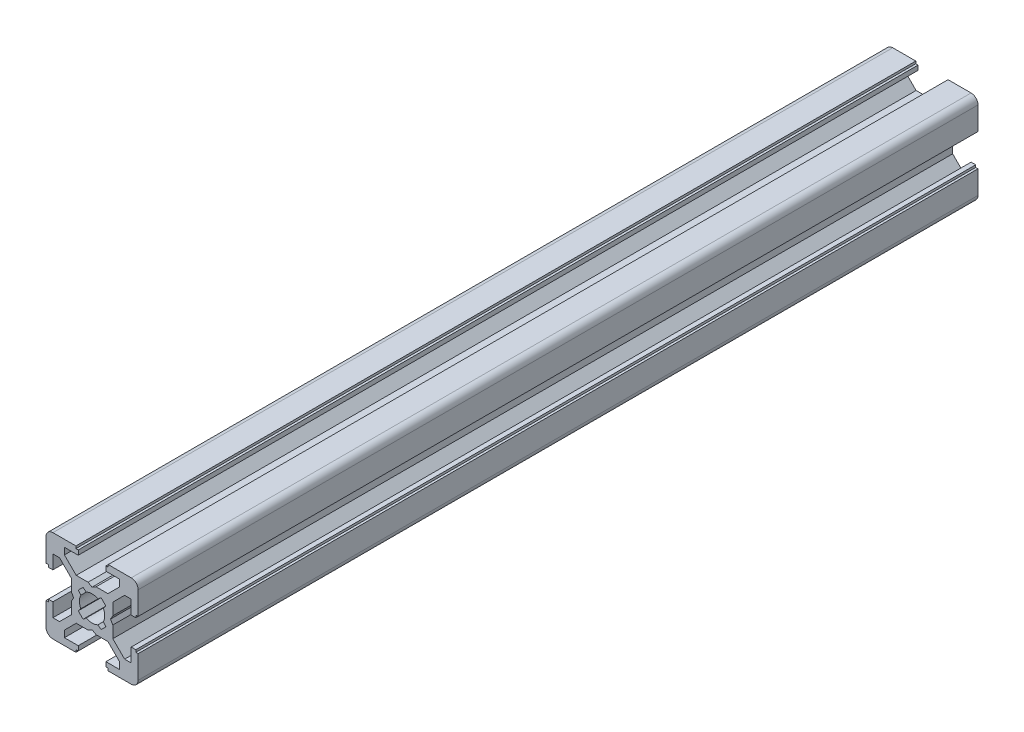
from build123d import *

# Parameters (mm, degrees)
BOSS_EXTRU_1_DEPTH      = 182.28
ENL_V_MAT_EXTRU_1_DEPTH = 183.827783447


with BuildPart() as part:
    # Esquisse1 → Boss.-Extru.1 (new body)
    with BuildSketch(Plane.XY):
        with BuildLine():
            Line((-4, 0), (-4.5, 0.866025404))
            Line((-4.5, 0.866025404), (-4.5, 3.439339828))
            Line((-4.5, 3.439339828), (-7.060660172, 6))
            Line((-7.060660172, 6), (-8.5, 6))
            Line((-8.5, 6), (-8.5, 3))
            Line((-8.5, 3), (-9.5, 3))
            Line((-9.5, 3), (-9.5, 3.5))
            Line((-9.5, 3.5), (-10, 3.5))
            Line((-10, 3.5), (-10, 8.5))
            ThreePointArc((-10, 8.5), (-9.560660172, 9.560660172), (-8.5, 10))
            Line((-8.5, 10), (-3.5, 10))
            Line((-3.5, 10), (-3.5, 9.5))
            Line((-3.5, 9.5), (-3, 9.5))
            Line((-3, 9.5), (-3, 8.5))
            Line((-3, 8.5), (-6, 8.5))
            Line((-6, 8.5), (-6, 7.060660172))
            Line((-6, 7.060660172), (-3.439339828, 4.5))
            Line((-3.439339828, 4.5), (-0.866025404, 4.5))
            Line((-0.866025404, 4.5), (0, 4))
            Line((0, 4), (0.866025404, 4.5))
            Line((0.866025404, 4.5), (3.439339828, 4.5))
            Line((3.439339828, 4.5), (6, 7.060660172))
            Line((6, 7.060660172), (6, 8.5))
            Line((6, 8.5), (3, 8.5))
            Line((3, 8.5), (3, 9.5))
            Line((3, 9.5), (3.5, 9.5))
            Line((3.5, 9.5), (3.5, 10))
            Line((3.5, 10), (8.5, 10))
            ThreePointArc((8.5, 10), (9.560660172, 9.560660172), (10, 8.5))
            Line((10, 8.5), (10, 3.5))
            Line((10, 3.5), (9.5, 3.5))
            Line((9.5, 3.5), (9.5, 3))
            Line((9.5, 3), (8.5, 3))
            Line((8.5, 3), (8.5, 6))
            Line((8.5, 6), (7.060660172, 6))
            Line((7.060660172, 6), (4.5, 3.439339828))
            Line((4.5, 3.439339828), (4.5, 0.866025404))
            Line((4.5, 0.866025404), (4, 0))
            Line((4, 0), (4.5, -0.866025404))
            Line((4.5, -0.866025404), (4.5, -3.439339828))
            Line((4.5, -3.439339828), (7.060660172, -6))
            Line((7.060660172, -6), (8.5, -6))
            Line((8.5, -6), (8.5, -3))
            Line((8.5, -3), (9.5, -3))
            Line((9.5, -3), (9.5, -3.5))
            Line((9.5, -3.5), (10, -3.5))
            Line((10, -3.5), (10, -8.5))
            ThreePointArc((10, -8.5), (9.560660172, -9.560660172), (8.5, -10))
            Line((8.5, -10), (3.5, -10))
            Line((3.5, -10), (3.5, -9.5))
            Line((3.5, -9.5), (3, -9.5))
            Line((3, -9.5), (3, -8.5))
            Line((3, -8.5), (6, -8.5))
            Line((6, -8.5), (6, -7.060660172))
            Line((6, -7.060660172), (3.439339828, -4.5))
            Line((3.439339828, -4.5), (0.866025404, -4.5))
            Line((0.866025404, -4.5), (0, -4))
            Line((0, -4), (-0.866025404, -4.5))
            Line((-0.866025404, -4.5), (-3.439339828, -4.5))
            Line((-3.439339828, -4.5), (-6, -7.060660172))
            Line((-6, -7.060660172), (-6, -8.5))
            Line((-6, -8.5), (-3, -8.5))
            Line((-3, -8.5), (-3, -9.5))
            Line((-3, -9.5), (-3.5, -9.5))
            Line((-3.5, -9.5), (-3.5, -10))
            Line((-3.5, -10), (-8.5, -10))
            ThreePointArc((-8.5, -10), (-9.560660172, -9.560660172), (-10, -8.5))
            Line((-10, -8.5), (-10, -3.5))
            Line((-10, -3.5), (-9.5, -3.5))
            Line((-9.5, -3.5), (-9.5, -3))
            Line((-9.5, -3), (-8.5, -3))
            Line((-8.5, -3), (-8.5, -6))
            Line((-8.5, -6), (-7.060660172, -6))
            Line((-7.060660172, -6), (-4.5, -3.439339828))
            Line((-4.5, -3.439339828), (-4.5, -0.866025404))
            Line((-4.5, -0.866025404), (-4, 0))
        make_face()
    extrude(amount=-BOSS_EXTRU_1_DEPTH)

    # Esquisse2 → Enlèv. mat.-Extru.1 (cut, through all)
    with BuildSketch(Plane.XY):
        with BuildLine():
            Line((1.949592103, 3.000876196), (1.276279893, 2.435900169))
            ThreePointArc((1.276279893, 2.435900169), (0.001756003, 2.749999439), (-1.273167982, 2.43752811))
            Line((-1.273167982, 2.43752811), (-1.947287092, 3.003181207))
            Line((-1.947287092, 3.003181207), (-3.000876196, 1.949592103))
            Line((-3.000876196, 1.949592103), (-2.435900169, 1.276279893))
            ThreePointArc((-2.435900169, 1.276279893), (-2.749999439, 0.001756003), (-2.43752811, -1.273167982))
            Line((-2.43752811, -1.273167982), (-3.003181207, -1.947287092))
            Line((-3.003181207, -1.947287092), (-1.949592103, -3.000876196))
            Line((-1.949592103, -3.000876196), (-1.276279893, -2.435900169))
            ThreePointArc((-1.276279893, -2.435900169), (-0.001756003, -2.749999439), (1.273167982, -2.43752811))
            Line((1.273167982, -2.43752811), (1.947287092, -3.003181207))
            Line((1.947287092, -3.003181207), (3.000876196, -1.949592103))
            Line((3.000876196, -1.949592103), (2.435900169, -1.276279893))
            ThreePointArc((2.435900169, -1.276279893), (2.749999439, -0.001756003), (2.43752811, 1.273167982))
            Line((2.43752811, 1.273167982), (3.003181207, 1.947287092))
            Line((3.003181207, 1.947287092), (1.949592103, 3.000876196))
        make_face()
    extrude(amount=-ENL_V_MAT_EXTRU_1_DEPTH, mode=Mode.SUBTRACT)


solid = part.part
